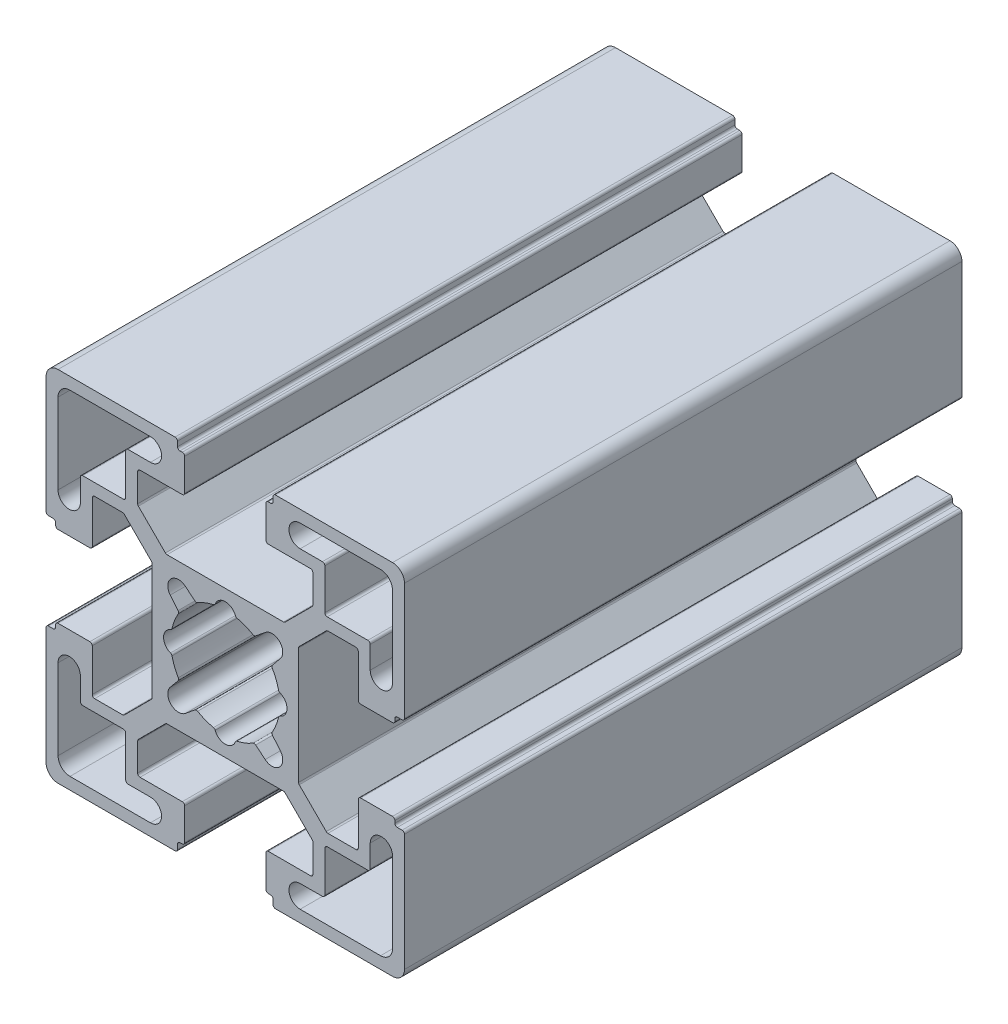
from build123d import *

# Parameters (mm, degrees)
RESSALTO_EXTRUS_O2_DEPTH = 70


with BuildPart() as part:
    # Sketch1 → Ressalto-extrusão2 (new body)
    with BuildSketch(Plane.XY):
        with BuildLine():
            Line((22.5, 6.3), (22.5, 21))
            ThreePointArc((22.5, 21), (22.060660172, 22.060660172), (21, 22.5))
            Line((21, 22.5), (6.3, 22.5))
            ThreePointArc((6.3, 22.5), (6.087867966, 22.412132034), (6, 22.2))
            Line((6, 22.2), (6, 21.6))
            ThreePointArc((6, 21.6), (5.912132034, 21.387867966), (5.7, 21.3))
            Line((5.7, 21.3), (5.4, 21.3))
            ThreePointArc((5.4, 21.3), (5.187867966, 21.212132034), (5.1, 21))
            Line((5.1, 21), (5.1, 17))
            ThreePointArc((5.1, 17), (5.187867966, 16.787867966), (5.4, 16.7))
            Line((5.4, 16.7), (10.7, 16.7))
            ThreePointArc((10.7, 16.7), (10.912132034, 16.612132034), (11, 16.4))
            Line((11, 16.4), (11, 12.892031022))
            ThreePointArc((11, 12.892031022), (10.97716386, 12.777225992), (10.912132034, 12.679898987))
            Line((10.912132034, 12.679898987), (7.520101013, 9.287867966))
            ThreePointArc((7.520101013, 9.287867966), (7.422774008, 9.22283614), (7.307968978, 9.2))
            Line((7.307968978, 9.2), (-7.307968978, 9.2))
            ThreePointArc((-7.307968978, 9.2), (-7.422774008, 9.22283614), (-7.520101013, 9.287867966))
            Line((-7.520101013, 9.287867966), (-10.912132034, 12.679898987))
            ThreePointArc((-10.912132034, 12.679898987), (-10.97716386, 12.777225992), (-11, 12.892031022))
            Line((-11, 12.892031022), (-11, 16.4))
            ThreePointArc((-11, 16.4), (-10.912132034, 16.612132034), (-10.7, 16.7))
            Line((-10.7, 16.7), (-5.4, 16.7))
            ThreePointArc((-5.4, 16.7), (-5.187867966, 16.787867966), (-5.1, 17))
            Line((-5.1, 17), (-5.1, 21))
            ThreePointArc((-5.1, 21), (-5.187867966, 21.212132034), (-5.4, 21.3))
            Line((-5.4, 21.3), (-5.7, 21.3))
            ThreePointArc((-5.7, 21.3), (-5.912132034, 21.387867966), (-6, 21.6))
            Line((-6, 21.6), (-6, 22.2))
            ThreePointArc((-6, 22.2), (-6.087867966, 22.412132034), (-6.3, 22.5))
            Line((-6.3, 22.5), (-21, 22.5))
            ThreePointArc((-21, 22.5), (-22.060660172, 22.060660172), (-22.5, 21))
            Line((-22.5, 21), (-22.5, 6.3))
            ThreePointArc((-22.5, 6.3), (-22.412132034, 6.087867966), (-22.2, 6))
            Line((-22.2, 6), (-21.6, 6))
            ThreePointArc((-21.6, 6), (-21.387867966, 5.912132034), (-21.3, 5.7))
            Line((-21.3, 5.7), (-21.3, 5.4))
            ThreePointArc((-21.3, 5.4), (-21.212132034, 5.187867966), (-21, 5.1))
            Line((-21, 5.1), (-17, 5.1))
            ThreePointArc((-17, 5.1), (-16.787867966, 5.187867966), (-16.7, 5.4))
            Line((-16.7, 5.4), (-16.7, 10.7))
            ThreePointArc((-16.7, 10.7), (-16.612132034, 10.912132034), (-16.4, 11))
            Line((-16.4, 11), (-12.892031022, 11))
            ThreePointArc((-12.892031022, 11), (-12.777225992, 10.97716386), (-12.679898987, 10.912132034))
            Line((-12.679898987, 10.912132034), (-9.287867966, 7.520101013))
            ThreePointArc((-9.287867966, 7.520101013), (-9.22283614, 7.422774008), (-9.2, 7.307968978))
            Line((-9.2, 7.307968978), (-9.2, -7.307968978))
            ThreePointArc((-9.2, -7.307968978), (-9.22283614, -7.422774008), (-9.287867966, -7.520101013))
            Line((-9.287867966, -7.520101013), (-12.679898987, -10.912132034))
            ThreePointArc((-12.679898987, -10.912132034), (-12.777225992, -10.97716386), (-12.892031022, -11))
            Line((-12.892031022, -11), (-16.4, -11))
            ThreePointArc((-16.4, -11), (-16.612132034, -10.912132034), (-16.7, -10.7))
            Line((-16.7, -10.7), (-16.7, -5.4))
            ThreePointArc((-16.7, -5.4), (-16.787867966, -5.187867966), (-17, -5.1))
            Line((-17, -5.1), (-21, -5.1))
            ThreePointArc((-21, -5.1), (-21.212132034, -5.187867966), (-21.3, -5.4))
            Line((-21.3, -5.4), (-21.3, -5.7))
            ThreePointArc((-21.3, -5.7), (-21.387867966, -5.912132034), (-21.6, -6))
            Line((-21.6, -6), (-22.2, -6))
            ThreePointArc((-22.2, -6), (-22.412132034, -6.087867966), (-22.5, -6.3))
            Line((-22.5, -6.3), (-22.5, -21))
            ThreePointArc((-22.5, -21), (-22.060660172, -22.060660172), (-21, -22.5))
            Line((-21, -22.5), (-6.3, -22.5))
            ThreePointArc((-6.3, -22.5), (-6.087867966, -22.412132034), (-6, -22.2))
            Line((-6, -22.2), (-6, -21.6))
            ThreePointArc((-6, -21.6), (-5.912132034, -21.387867966), (-5.7, -21.3))
            Line((-5.7, -21.3), (-5.4, -21.3))
            ThreePointArc((-5.4, -21.3), (-5.187867966, -21.212132034), (-5.1, -21))
            Line((-5.1, -21), (-5.1, -17))
            ThreePointArc((-5.1, -17), (-5.187867966, -16.787867966), (-5.4, -16.7))
            Line((-5.4, -16.7), (-10.7, -16.7))
            ThreePointArc((-10.7, -16.7), (-10.912132034, -16.612132034), (-11, -16.4))
            Line((-11, -16.4), (-11, -12.892031022))
            ThreePointArc((-11, -12.892031022), (-10.97716386, -12.777225992), (-10.912132034, -12.679898987))
            Line((-10.912132034, -12.679898987), (-7.432233047, -9.2))
            Line((-7.432233047, -9.2), (7.307968978, -9.2))
            ThreePointArc((7.307968978, -9.2), (7.422774008, -9.22283614), (7.520101013, -9.287867966))
            Line((7.520101013, -9.287867966), (10.912132034, -12.679898987))
            ThreePointArc((10.912132034, -12.679898987), (10.97716386, -12.777225992), (11, -12.892031022))
            Line((11, -12.892031022), (11, -16.4))
            ThreePointArc((11, -16.4), (10.912132034, -16.612132034), (10.7, -16.7))
            Line((10.7, -16.7), (5.4, -16.7))
            ThreePointArc((5.4, -16.7), (5.187867966, -16.787867966), (5.1, -17))
            Line((5.1, -17), (5.1, -21))
            ThreePointArc((5.1, -21), (5.187867966, -21.212132034), (5.4, -21.3))
            Line((5.4, -21.3), (5.7, -21.3))
            ThreePointArc((5.7, -21.3), (5.912132034, -21.387867966), (6, -21.6))
            Line((6, -21.6), (6, -22.2))
            ThreePointArc((6, -22.2), (6.087867966, -22.412132034), (6.3, -22.5))
            Line((6.3, -22.5), (21, -22.5))
            ThreePointArc((21, -22.5), (22.060660172, -22.060660172), (22.5, -21))
            Line((22.5, -21), (22.5, -6.3))
            ThreePointArc((22.5, -6.3), (22.412132034, -6.087867966), (22.2, -6))
            Line((22.2, -6), (21.6, -6))
            ThreePointArc((21.6, -6), (21.387867966, -5.912132034), (21.3, -5.7))
            Line((21.3, -5.7), (21.3, -5.4))
            ThreePointArc((21.3, -5.4), (21.212132034, -5.187867966), (21, -5.1))
            Line((21, -5.1), (17, -5.1))
            ThreePointArc((17, -5.1), (16.787867966, -5.187867966), (16.7, -5.4))
            Line((16.7, -5.4), (16.7, -10.7))
            ThreePointArc((16.7, -10.7), (16.612132034, -10.912132034), (16.4, -11))
            Line((16.4, -11), (12.892031022, -11))
            ThreePointArc((12.892031022, -11), (12.777225992, -10.97716386), (12.679898987, -10.912132034))
            Line((12.679898987, -10.912132034), (9.287867966, -7.520101013))
            ThreePointArc((9.287867966, -7.520101013), (9.22283614, -7.422774008), (9.2, -7.307968978))
            Line((9.2, -7.307968978), (9.2, 7.307968978))
            ThreePointArc((9.2, 7.307968978), (9.22283614, 7.422774008), (9.287867966, 7.520101013))
            Line((9.287867966, 7.520101013), (12.679898987, 10.912132034))
            ThreePointArc((12.679898987, 10.912132034), (12.777225992, 10.97716386), (12.892031022, 11))
            Line((12.892031022, 11), (16.4, 11))
            ThreePointArc((16.4, 11), (16.612132034, 10.912132034), (16.7, 10.7))
            Line((16.7, 10.7), (16.7, 5.4))
            ThreePointArc((16.7, 5.4), (16.787867966, 5.187867966), (17, 5.1))
            Line((17, 5.1), (21, 5.1))
            ThreePointArc((21, 5.1), (21.212132034, 5.187867966), (21.3, 5.4))
            Line((21.3, 5.4), (21.3, 5.7))
            ThreePointArc((21.3, 5.7), (21.387867966, 5.912132034), (21.6, 6))
            Line((21.6, 6), (22.2, 6))
            ThreePointArc((22.2, 6), (22.412132034, 6.087867966), (22.5, 6.3))
        make_face()
        with BuildLine():
            Line((-3.818215474, 5.929763323), (-5.011190062, 6.911428437))
            ThreePointArc((-5.011190062, 6.911428437), (-6.823580438, 6.823580438), (-6.911428437, 5.011190062))
            Line((-6.911428437, 5.011190062), (-5.929763323, 3.818215474))
            ThreePointArc((-5.929763323, 3.818215474), (-5.862334174, 3.651033002), (-5.902896136, 3.475387346))
            ThreePointArc((-5.902896136, 3.475387346), (-6.374221536, 2.50834603), (-6.68833042, 1.479437798))
            ThreePointArc((-6.68833042, 1.479437798), (-6.754573553, 1.347716602), (-6.875568182, 1.263461477))
            ThreePointArc((-6.875568182, 1.263461477), (-7.75, 0), (-6.875568182, -1.263461477))
            ThreePointArc((-6.875568182, -1.263461477), (-6.754573553, -1.347716602), (-6.68833042, -1.479437798))
            ThreePointArc((-6.68833042, -1.479437798), (-6.374221536, -2.50834603), (-5.902896136, -3.475387346))
            ThreePointArc((-5.902896136, -3.475387346), (-5.862334174, -3.651033002), (-5.929763323, -3.818215474))
            Line((-5.929763323, -3.818215474), (-6.911428437, -5.011190062))
            ThreePointArc((-6.911428437, -5.011190062), (-6.823580438, -6.823580438), (-5.011190062, -6.911428437))
            Line((-5.011190062, -6.911428437), (-3.818215474, -5.929763323))
            ThreePointArc((-3.818215474, -5.929763323), (-3.651033002, -5.862334174), (-3.475387346, -5.902896136))
            ThreePointArc((-3.475387346, -5.902896136), (-2.50834603, -6.374221536), (-1.479437798, -6.68833042))
            ThreePointArc((-1.479437798, -6.68833042), (-1.347716602, -6.754573553), (-1.263461477, -6.875568182))
            ThreePointArc((-1.263461477, -6.875568182), (0, -7.75), (1.263461477, -6.875568182))
            ThreePointArc((1.263461477, -6.875568182), (1.347716602, -6.754573553), (1.479437798, -6.68833042))
            ThreePointArc((1.479437798, -6.68833042), (2.50834603, -6.374221536), (3.475387346, -5.902896136))
            ThreePointArc((3.475387346, -5.902896136), (3.651033002, -5.862334174), (3.818215474, -5.929763323))
            Line((3.818215474, -5.929763323), (5.011190062, -6.911428437))
            ThreePointArc((5.011190062, -6.911428437), (6.823580438, -6.823580438), (6.911428437, -5.011190062))
            Line((6.911428437, -5.011190062), (5.929763323, -3.818215474))
            ThreePointArc((5.929763323, -3.818215474), (5.862334174, -3.651033002), (5.902896136, -3.475387346))
            ThreePointArc((5.902896136, -3.475387346), (6.374221536, -2.50834603), (6.68833042, -1.479437798))
            ThreePointArc((6.68833042, -1.479437798), (6.754573553, -1.347716602), (6.875568182, -1.263461477))
            ThreePointArc((6.875568182, -1.263461477), (7.75, 0), (6.875568182, 1.263461477))
            ThreePointArc((6.875568182, 1.263461477), (6.754573553, 1.347716602), (6.68833042, 1.479437798))
            ThreePointArc((6.68833042, 1.479437798), (6.374221536, 2.50834603), (5.902896136, 3.475387346))
            ThreePointArc((5.902896136, 3.475387346), (5.862334174, 3.651033002), (5.929763323, 3.818215474))
            Line((5.929763323, 3.818215474), (6.911428437, 5.011190062))
            ThreePointArc((6.911428437, 5.011190062), (6.823580438, 6.823580438), (5.011190062, 6.911428437))
            Line((5.011190062, 6.911428437), (3.818215474, 5.929763323))
            ThreePointArc((3.818215474, 5.929763323), (3.651033002, 5.862334174), (3.475387346, 5.902896136))
            ThreePointArc((3.475387346, 5.902896136), (2.50834603, 6.374221536), (1.479437798, 6.68833042))
            ThreePointArc((1.479437798, 6.68833042), (1.347716602, 6.754573553), (1.263461477, 6.875568182))
            ThreePointArc((1.263461477, 6.875568182), (0, 7.75), (-1.263461477, 6.875568182))
            ThreePointArc((-1.263461477, 6.875568182), (-1.347716602, 6.754573553), (-1.479437798, 6.68833042))
            ThreePointArc((-1.479437798, 6.68833042), (-2.50834603, 6.374221536), (-3.475387346, 5.902896136))
            ThreePointArc((-3.475387346, 5.902896136), (-3.651033002, 5.862334174), (-3.818215474, 5.929763323))
        make_face(mode=Mode.SUBTRACT)
        with BuildLine():
            Line((-19.5, -21), (-9.4, -21))
            ThreePointArc((-9.4, -21), (-8, -19.6), (-9.4, -18.2))
            Line((-9.4, -18.2), (-12.2, -18.2))
            ThreePointArc((-12.2, -18.2), (-12.412132034, -18.112132034), (-12.5, -17.9))
            Line((-12.5, -17.9), (-12.5, -12.8))
            ThreePointArc((-12.5, -12.8), (-12.587867966, -12.587867966), (-12.8, -12.5))
            Line((-12.8, -12.5), (-17.9, -12.5))
            ThreePointArc((-17.9, -12.5), (-18.112132034, -12.412132034), (-18.2, -12.2))
            Line((-18.2, -12.2), (-18.2, -9.4))
            ThreePointArc((-18.2, -9.4), (-19.6, -8), (-21, -9.4))
            Line((-21, -9.4), (-21, -19.5))
            ThreePointArc((-21, -19.5), (-20.560660172, -20.560660172), (-19.5, -21))
        make_face(mode=Mode.SUBTRACT)
        with BuildLine():
            Line((17.9, -12.5), (12.8, -12.5))
            ThreePointArc((12.8, -12.5), (12.587867966, -12.587867966), (12.5, -12.8))
            Line((12.5, -12.8), (12.5, -17.9))
            ThreePointArc((12.5, -17.9), (12.412132034, -18.112132034), (12.2, -18.2))
            Line((12.2, -18.2), (9.4, -18.2))
            ThreePointArc((9.4, -18.2), (8, -19.6), (9.4, -21))
            Line((9.4, -21), (19.5, -21))
            ThreePointArc((19.5, -21), (20.560660172, -20.560660172), (21, -19.5))
            Line((21, -19.5), (21, -9.4))
            ThreePointArc((21, -9.4), (19.6, -8), (18.2, -9.4))
            Line((18.2, -9.4), (18.2, -12.2))
            ThreePointArc((18.2, -12.2), (18.112132034, -12.412132034), (17.9, -12.5))
        make_face(mode=Mode.SUBTRACT)
        with BuildLine():
            Line((19.5, 21), (9.4, 21))
            ThreePointArc((9.4, 21), (8, 19.6), (9.4, 18.2))
            Line((9.4, 18.2), (12.2, 18.2))
            ThreePointArc((12.2, 18.2), (12.412132034, 18.112132034), (12.5, 17.9))
            Line((12.5, 17.9), (12.5, 12.8))
            ThreePointArc((12.5, 12.8), (12.587867966, 12.587867966), (12.8, 12.5))
            Line((12.8, 12.5), (17.9, 12.5))
            ThreePointArc((17.9, 12.5), (18.112132034, 12.412132034), (18.2, 12.2))
            Line((18.2, 12.2), (18.2, 9.4))
            ThreePointArc((18.2, 9.4), (19.6, 8), (21, 9.4))
            Line((21, 9.4), (21, 19.5))
            ThreePointArc((21, 19.5), (20.560660172, 20.560660172), (19.5, 21))
        make_face(mode=Mode.SUBTRACT)
        with BuildLine():
            Line((-18.2, 9.4), (-18.2, 12.2))
            ThreePointArc((-18.2, 12.2), (-18.112132034, 12.412132034), (-17.9, 12.5))
            Line((-17.9, 12.5), (-12.8, 12.5))
            ThreePointArc((-12.8, 12.5), (-12.587867966, 12.587867966), (-12.5, 12.8))
            Line((-12.5, 12.8), (-12.5, 17.9))
            ThreePointArc((-12.5, 17.9), (-12.412132034, 18.112132034), (-12.2, 18.2))
            Line((-12.2, 18.2), (-9.4, 18.2))
            ThreePointArc((-9.4, 18.2), (-8, 19.6), (-9.4, 21))
            Line((-9.4, 21), (-19.5, 21))
            ThreePointArc((-19.5, 21), (-20.560660172, 20.560660172), (-21, 19.5))
            Line((-21, 19.5), (-21, 9.4))
            ThreePointArc((-21, 9.4), (-19.6, 8), (-18.2, 9.4))
        make_face(mode=Mode.SUBTRACT)
    extrude(amount=RESSALTO_EXTRUS_O2_DEPTH)


solid = part.part
